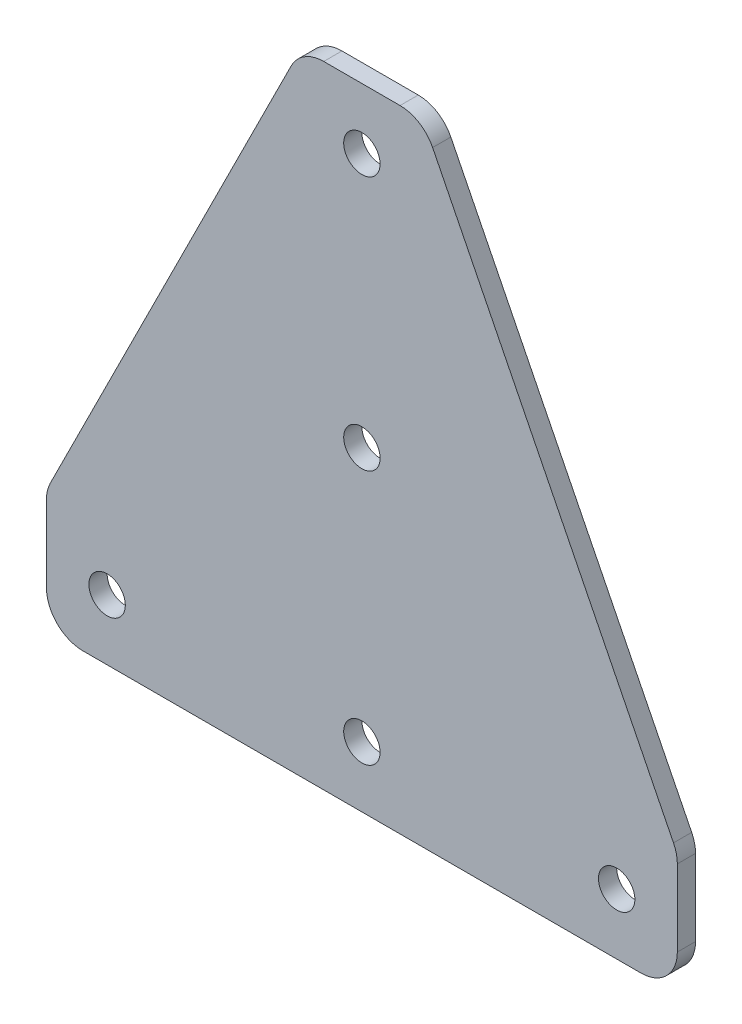
from build123d import *

# Parameters (mm, degrees)
ESQUISSE1_W             = 52
ESQUISSE1_H             = 52
ESQUISSE1_R             = 1.5
BOSS_EXTRU_1_DEPTH      = 1.5
ENL_V_MAT_EXTRU_1_DEPTH = 54.73313689
CONG_1_R                = 3


with BuildPart() as part:
    # Esquisse1 → Boss.-Extru.1 (new body)
    with BuildSketch(Plane.XY):
        with Locations((0, 21)):
            Rectangle(ESQUISSE1_W, ESQUISSE1_H)
        with Locations((-21, 0)):
            Circle(ESQUISSE1_R, mode=Mode.SUBTRACT)
        Circle(ESQUISSE1_R, mode=Mode.SUBTRACT)
        with Locations((21, 0)):
            Circle(ESQUISSE1_R, mode=Mode.SUBTRACT)
        with Locations((0, 42)):
            Circle(ESQUISSE1_R, mode=Mode.SUBTRACT)
        with Locations((0, 21)):
            Circle(ESQUISSE1_R, mode=Mode.SUBTRACT)
    extrude(amount=BOSS_EXTRU_1_DEPTH)

    # Esquisse2 → Enlèv. mat.-Extru.1 (cut, through all)
    with BuildSketch(Plane.XY.offset(1.5)):
        Polygon((-26, 47), (-5, 47), (-26, 5), align=None)
        Polygon((26, 47), (26, 5), (5, 47), align=None)
    extrude(amount=-ENL_V_MAT_EXTRU_1_DEPTH, mode=Mode.SUBTRACT)

    # Congé1
    cong_1_edges = [part.edges().sort_by_distance(p)[0] for p in [
        (-26, 5, 0.75),
        (-5, 47, 0.75),
        (5, 47, 0.75),
        (26, 5, 0.75),
        (26, -5, 0.75),
        (-26, -5, 0.75),
    ]]
    fillet(cong_1_edges, radius=CONG_1_R)


solid = part.part
